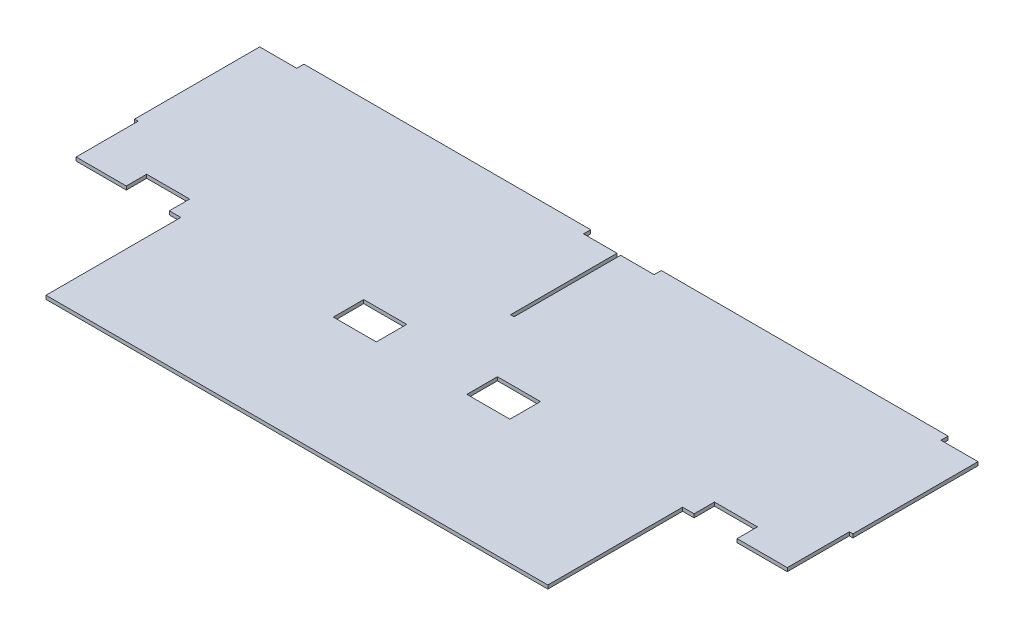
from build123d import *

# Parameters (mm, degrees)
SKETCH1_W           = 629.90984
SKETCH1_H           = 147.69846
BOSS_EXTRUDE1_DEPTH = 3.175
SKETCH3_W           = 254
SKETCH3_H           = 3.175
BOSS_EXTRUDE2_DEPTH = 6.35
SKETCH4_W           = 3.175
SKETCH4_H           = 188.732840052
CUT_EXTRUDE1_DEPTH  = 3.175
SKETCH6_W           = 3.175
SKETCH6_H           = 110.773845
BOSS_EXTRUDE4_DEPTH = 3.175
SKETCH8_W           = 629.90984
SKETCH8_H           = 18.04416
BOSS_EXTRUDE5_DEPTH = 3.175
SKETCH10_W          = 38.1
SKETCH10_H          = 18.04416
SKETCH10_H_2        = 36.08832
CUT_EXTRUDE3_DEPTH  = 652.56536379
BOSS_EXTRUDE6_DEPTH = 3.175


with BuildPart() as part:
    # Sketch1 → Boss-Extrude1 (new body)
    with BuildSketch(Plane(origin=(0, 0, 0), x_dir=(1, 0, 0), z_dir=(0, 1, 0))):
        with Locations((314.95492, 73.84923)):
            Rectangle(SKETCH1_W, SKETCH1_H)
    extrude(amount=BOSS_EXTRUDE1_DEPTH)

    # Sketch3 → Boss-Extrude2 (add)
    with BuildSketch(Plane(origin=(0, 0, -147.69846), x_dir=(-1, 0, 0), z_dir=(0, 0, -1))):
        with Locations((-473.22613, 1.5875)):
            Rectangle(SKETCH3_W, SKETCH3_H)
        with Locations((-156.68371, 1.5875)):
            Rectangle(SKETCH3_W, SKETCH3_H)
    extrude(amount=BOSS_EXTRUDE2_DEPTH)

    # Sketch4 → Cut-Extrude1 (cut)
    with BuildSketch(Plane(origin=(0, 3.175, 0), x_dir=(1, 0, 0), z_dir=(0, 1, 0))):
        with Locations((314.95492, 147.69846)):
            Rectangle(SKETCH4_W, SKETCH4_H)
    extrude(amount=-CUT_EXTRUDE1_DEPTH, mode=Mode.SUBTRACT)

    # Sketch6 → Boss-Extrude4 (add)
    with BuildSketch(Plane(origin=(0, 3.175, 0), x_dir=(1, 0, 0), z_dir=(0, 1, 0))):
        with Locations((631.49734, 92.3115375)):
            Rectangle(SKETCH6_W, SKETCH6_H)
        with Locations((-1.5875, 92.3115375)):
            Rectangle(SKETCH6_W, SKETCH6_H)
    extrude(amount=-BOSS_EXTRUDE4_DEPTH)

    # Sketch8 → Boss-Extrude5 (add, through all)
    with BuildSketch(Plane(origin=(0, 3.175, 0), x_dir=(1, 0, 0), z_dir=(0, 1, 0))):
        with Locations((314.95492, -9.02208)):
            Rectangle(SKETCH8_W, SKETCH8_H)
    extrude(amount=-BOSS_EXTRUDE5_DEPTH)

    # Sketch10 → Cut-Extrude3 (cut, through all)
    with BuildSketch(Plane(origin=(0, 3.175, 0), x_dir=(1, 0, 0), z_dir=(0, 1, 0))):
        with Locations((374.1674, -9.02208)):
            Rectangle(SKETCH10_W, SKETCH10_H)
        with Locations((255.74244, -9.02208)):
            Rectangle(SKETCH10_W, SKETCH10_H)
        with Locations((566.40984, -18.04416)):
            Rectangle(SKETCH10_W, SKETCH10_H_2)
        with Locations((63.5, -18.04416)):
            Rectangle(SKETCH10_W, SKETCH10_H_2)
    extrude(amount=-CUT_EXTRUDE3_DEPTH, mode=Mode.SUBTRACT)

    # Sketch11 → Boss-Extrude6 (add, through all)
    with BuildSketch(Plane(origin=(0, 3.175, 0), x_dir=(1, 0, 0), z_dir=(0, 1, 0))):
        Polygon((92.70492, -18.04416), (92.70492, -137.42416), (537.20492, -137.42416), (537.20492, -18.04416), (393.2174, -18.04416), (393.2174, -27.06624), (355.1174, -27.06624), (355.1174, -18.04416), (274.79244, -18.04416), (274.79244, -26.95194), (236.69244, -26.95194), (236.69244, -18.04416), align=None)
    extrude(amount=-BOSS_EXTRUDE6_DEPTH)


solid = part.part
